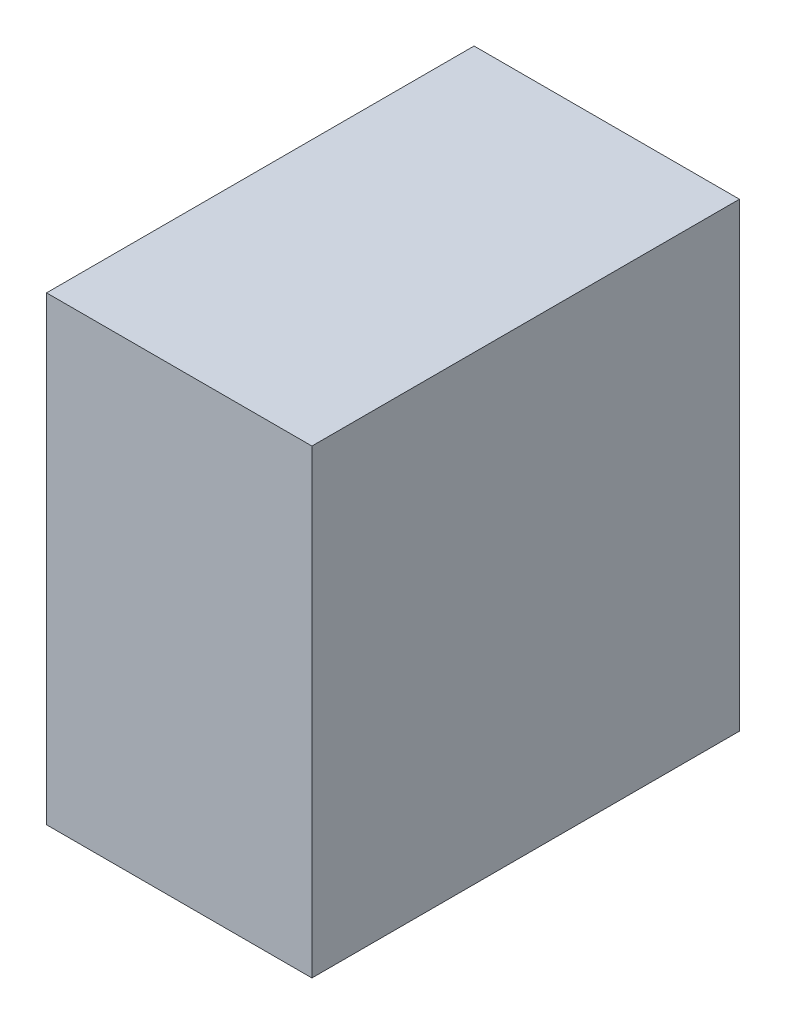
from build123d import *

# Parameters (mm, degrees)
SKETCH1_W           = 360
SKETCH1_H           = 580
BOSS_EXTRUDE1_DEPTH = 625


with BuildPart() as part:
    # Sketch1 → Boss-Extrude1 (new body)
    with BuildSketch(Plane(origin=(0, 0, 0), x_dir=(1, 0, 0), z_dir=(0, 1, 0))):
        Rectangle(SKETCH1_W, SKETCH1_H)
    extrude(amount=BOSS_EXTRUDE1_DEPTH)


solid = part.part
